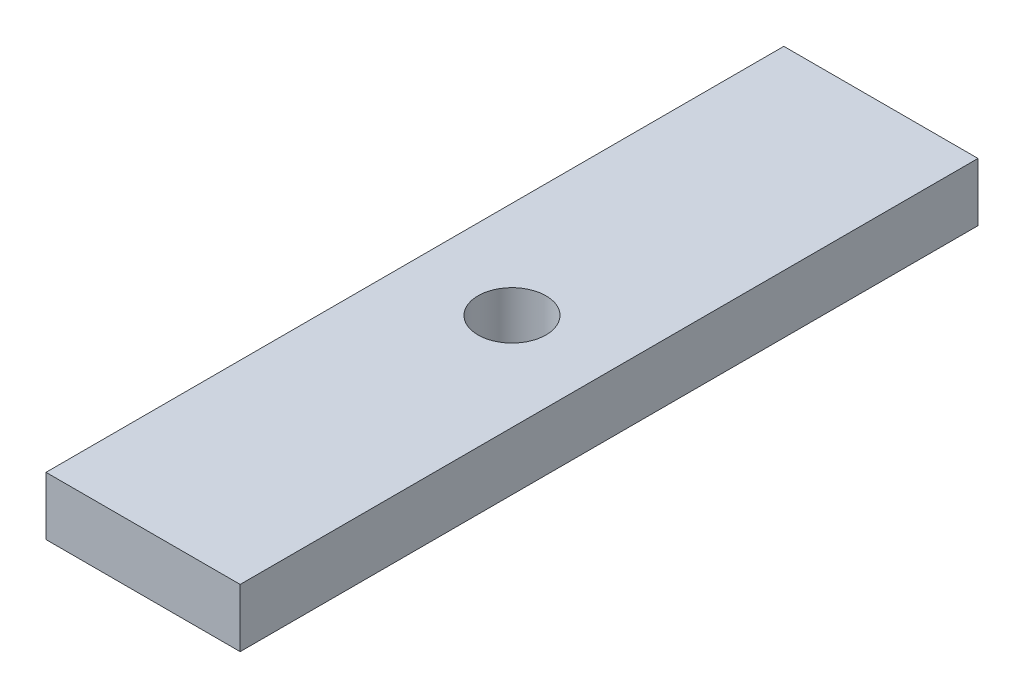
from build123d import *

# Parameters (mm, degrees)
SKETCH1_W           = 38
SKETCH1_H           = 3
BOSS_EXTRUDE2_DEPTH = 10
SKETCH2_R           = 1.75
CUT_EXTRUDE1_DEPTH  = 10


with BuildPart() as part:
    # Sketch1 → Boss-Extrude2 (new body)
    with BuildSketch(Plane(origin=(0, 0, 0), x_dir=(0, 0, -1), z_dir=(1, 0, 0))):
        with Locations((-19, 1.5)):
            Rectangle(SKETCH1_W, SKETCH1_H)
    extrude(amount=BOSS_EXTRUDE2_DEPTH)

    # Sketch2 → Cut-Extrude1 (cut)
    with BuildSketch(Plane(origin=(0, 3, 0), x_dir=(1, 0, 0), z_dir=(0, 1, 0))):
        with Locations(Location((5, -19, 0), (0, 0, 270))):
            Circle(SKETCH2_R)
    extrude(amount=-CUT_EXTRUDE1_DEPTH, mode=Mode.SUBTRACT)


solid = part.part
